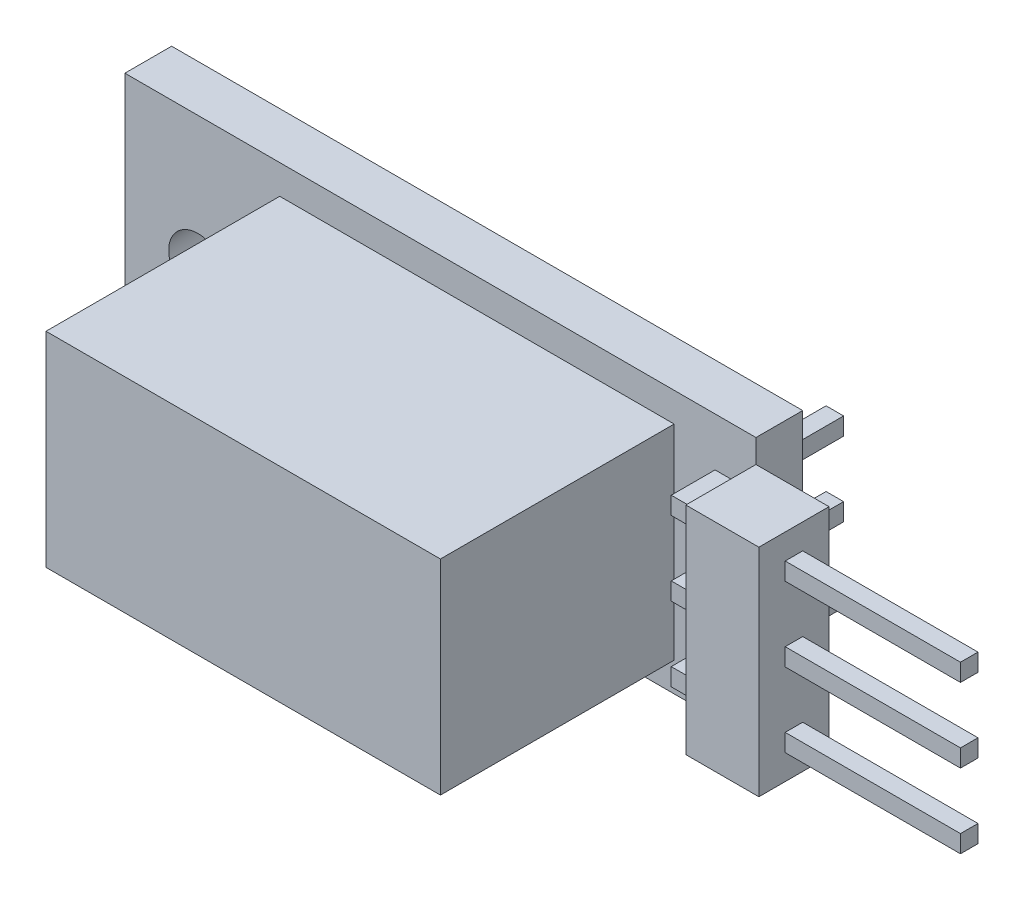
from build123d import *

# Parameters (mm, degrees)
ESQUISSE1_W                = 21.6
ESQUISSE1_H                = 9
BOSS_EXTRU_1_DEPTH         = 1.6
BOSS_EXTRU_2_DEPTH         = 8
BOSS_EXTRU_2_DEPTH_BACK    = 2.5
ESQUISSE2_W                = 13.5
ESQUISSE2_H                = 7
ESQUISSE3_R                = 1
ENL_V_MAT_EXTRU_1_DEPTH    = 25.729739182
ESQUISSE4_W                = 2.4
ESQUISSE4_H                = 7.4
BOSS_EXTRU_3_DEPTH         = 2.5
BOSS_EXTRU_5_START         = -1.46
BOSS_EXTRU_5_DEPTH         = 0.6
R_P_TITION_LIN_AIRE1_COUNT = 3
R_P_TITION_LIN_AIRE1_PITCH = 2.54


with BuildPart() as part:
    # Esquisse1 → Boss.-Extru.1 (new body)
    with BuildSketch(Plane.XY):
        with Locations((10.8, 4.5)):
            Rectangle(ESQUISSE1_W, ESQUISSE1_H)
    extrude(amount=BOSS_EXTRU_1_DEPTH)

    # Esquisse3 → Enlèv. mat.-Extru.1 (cut, through all)
    with BuildSketch(Plane.XY.offset(1.6)):
        with Locations((2.5, 4.5)):
            Circle(ESQUISSE3_R)
    extrude(amount=-ENL_V_MAT_EXTRU_1_DEPTH, mode=Mode.SUBTRACT)


with BuildPart() as body_2:
    # Esquisse2 → Boss.-Extru.2 (new, two sides: drawn at the far end of the back side and taken through both)
    with BuildSketch(Plane.XY.offset(1.6).offset(-BOSS_EXTRU_2_DEPTH_BACK)):
        with Locations((12.05, 4.5)):
            Rectangle(ESQUISSE2_W, ESQUISSE2_H)
    extrude(amount=BOSS_EXTRU_2_DEPTH + BOSS_EXTRU_2_DEPTH_BACK)


with BuildPart() as body_3:
    # Esquisse4 → Boss.-Extru.3 (new body)
    with BuildSketch(Plane(origin=(21.6, 0, 0), x_dir=(0, 0, -1), z_dir=(1, 0, 0))):
        with Locations((-2.8, 4.5)):
            Rectangle(ESQUISSE4_W, ESQUISSE4_H)
    extrude(amount=BOSS_EXTRU_3_DEPTH)


with BuildPart() as body_4:
    # Esquisse5 → Boss.-Extru.5 (new body)
    with BuildSketch(Plane.XZ.offset(-0.8).offset(BOSS_EXTRU_5_START)):
        Polygon((30.1, 3.1), (20.2, 3.1), (20.2, -2.2), (20.8, -2.2), (20.8, 2.5), (30.1, 2.5), align=None)
    extrude(amount=BOSS_EXTRU_5_DEPTH)


with BuildPart() as r_p_tition_lin_aire1_1:
    # Répétition linéaire1: pattern copy
    add(body_4.part.moved(Location(Vector(0, 1, 0) * (1 * R_P_TITION_LIN_AIRE1_PITCH))))


with BuildPart() as r_p_tition_lin_aire1_2:
    # Répétition linéaire1: pattern copy
    add(body_4.part.moved(Location(Vector(0, 1, 0) * (2 * R_P_TITION_LIN_AIRE1_PITCH))))


solid = Compound([part.part, body_2.part, body_3.part, body_4.part, r_p_tition_lin_aire1_1.part, r_p_tition_lin_aire1_2.part])
